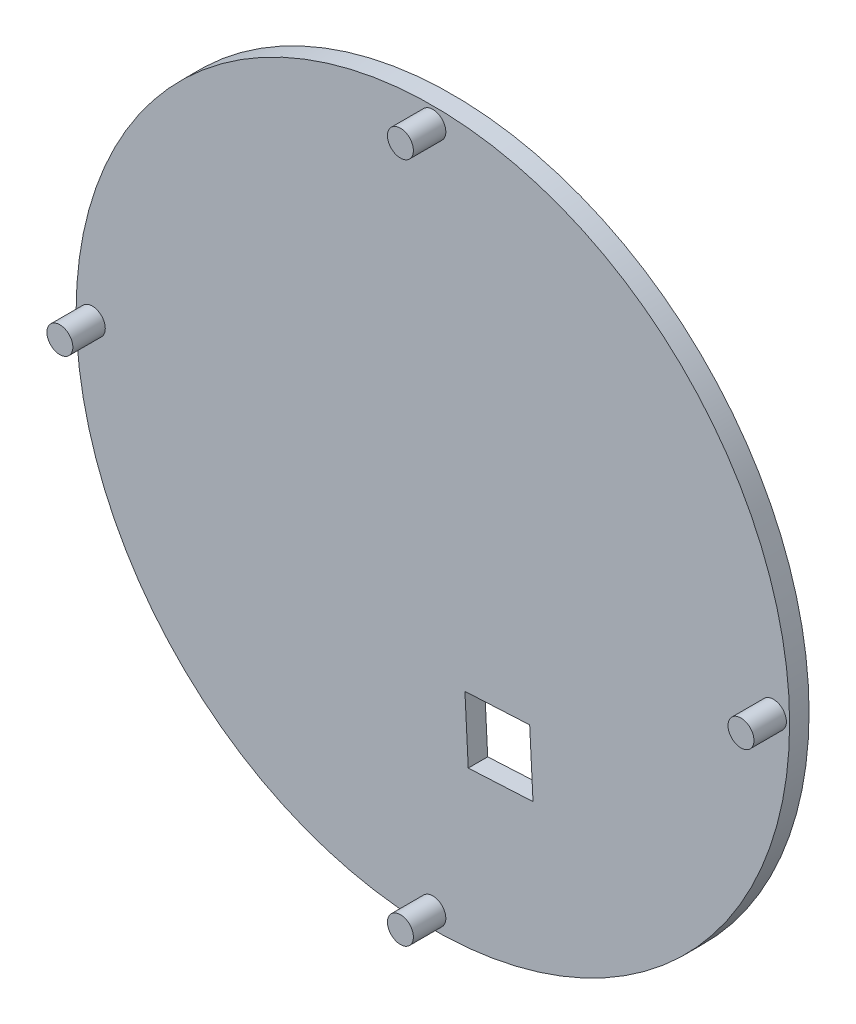
from build123d import *

# Parameters (mm, degrees)
SKETCH1_R           = 55
BOSS_EXTRUDE1_DEPTH = 3
SKETCH2_R           = 2
BOSS_EXTRUDE2_DEPTH = 5
CUT_EXTRUDE2_DEPTH  = 1.5
CUT_EXTRUDE3_DEPTH  = 23.5


with BuildPart() as part:
    # Sketch1 → Boss-Extrude1 (new body)
    with BuildSketch(Plane.XY):
        Circle(SKETCH1_R)
    extrude(amount=BOSS_EXTRUDE1_DEPTH)

    # Sketch2 → Boss-Extrude2 (add)
    with BuildSketch(Plane.XY.offset(3)):
        with Locations((0, 52.50213424)):
            Circle(SKETCH2_R)
        with Locations((52.50213424, 0)):
            Circle(SKETCH2_R)
        with Locations((0, -52.50213424)):
            Circle(SKETCH2_R)
        with Locations((-52.50213424, 0)):
            Circle(SKETCH2_R)
    extrude(amount=BOSS_EXTRUDE2_DEPTH)

    # Sketch5 → Cut-Extrude2 (cut)
    with BuildSketch(Plane(origin=(0, 0, 0), x_dir=(-1, 0, 0), z_dir=(0, 0, -1))):
        with BuildLine():
            Line((-2, 3.425408406), (-2, 8.425408406))
            ThreePointArc((-2, 8.425408406), (0, 10.425408406), (2, 8.425408406))
            Line((2, 8.425408406), (2, 3.425408406))
            Line((2, 3.425408406), (15.926066161, 1.98850852))
            ThreePointArc((15.926066161, 1.98850852), (17.719893525, 0.015831878), (15.957535976, -1.985009349))
            Line((15.957535976, -1.985009349), (2, -3.074591594))
            Line((2, -3.074591594), (2, -8.574591594))
            ThreePointArc((2, -8.574591594), (0, -10.574591594), (-2, -8.574591594))
            Line((-2, -8.574591594), (-2, -3.574591594))
            Line((-2, -3.574591594), (-18.913070191, -1.874440835))
            ThreePointArc((-18.913070191, -1.874440835), (-20.71285333, 0.115332129), (-18.913070191, 2.105105093))
            Line((-18.913070191, 2.105105093), (-2, 3.425408406))
        make_face()
    extrude(amount=-CUT_EXTRUDE2_DEPTH, mode=Mode.SUBTRACT)

    # Sketch7 → Cut-Extrude3 (cut)
    with BuildSketch(Plane(origin=(0, 0, 0), x_dir=(-1, 0, 0), z_dir=(0, 0, -1))):
        Polygon((-14.927590982, -20.209975768), (-15.441616431, -30.196755922), (-5.454836278, -30.710781371), (-4.940810829, -20.724001217), align=None)
    extrude(amount=-CUT_EXTRUDE3_DEPTH, mode=Mode.SUBTRACT)


solid = part.part
